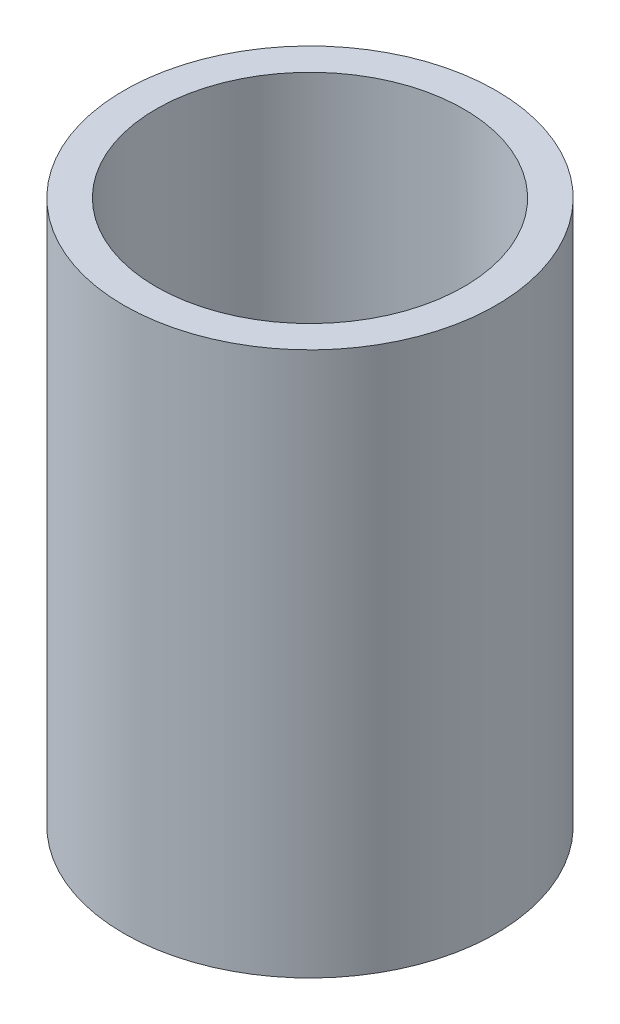
from build123d import *

# Parameters (mm, degrees)
SKETCH1_R           = 6.5
SKETCH1_R_2         = 5.375
BOSS_EXTRUDE1_DEPTH = 19


with BuildPart() as part:
    # Sketch1 → Boss-Extrude1 (new body)
    with BuildSketch(Plane(origin=(0.121948519, -28.862567759, 6.400144961), x_dir=(1, 0, 0), z_dir=(0, 1, 0))):
        with Locations(Location((-0.121948519, 6.400144961, 0), (0, 0, 270))):
            Circle(SKETCH1_R)
        with Locations(Location((-0.121948519, 6.400144961, 0), (0, 0, 270))):
            Circle(SKETCH1_R_2, mode=Mode.SUBTRACT)
    extrude(amount=BOSS_EXTRUDE1_DEPTH)


solid = part.part
